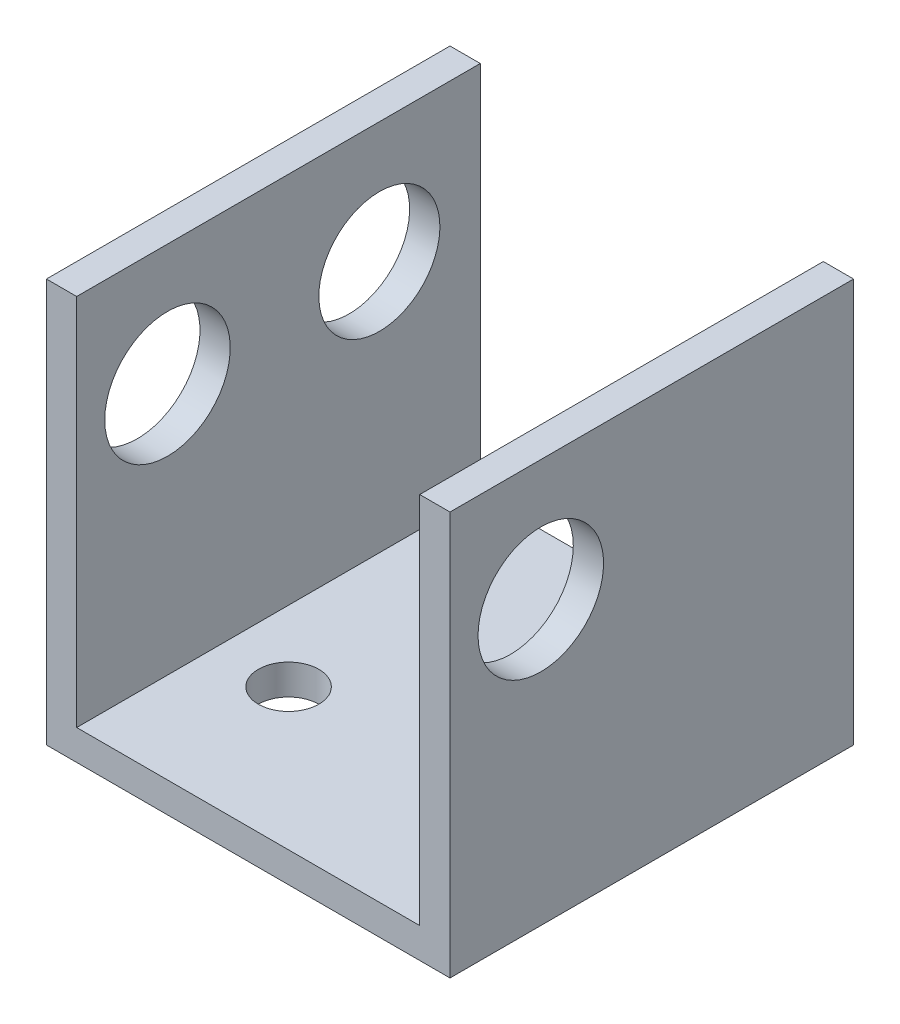
from build123d import *

# Parameters (mm, degrees)
EXTRUSION1_DEPTH = 20
ESQUISSE2_R      = 1.5
EXTRUSION2_DEPTH = 42.382154348
ESQUISSE4_R      = 3
EXTRUSION3_DEPTH = 32.911544508
ESQUISSE5_R      = 3.11
EXTRUSION4_DEPTH = 33.803912463


with BuildPart() as part:
    # Esquisse1 → Extrusion1 (new body)
    with BuildSketch(Plane.XY):
        Polygon((-31.14855853, 3.383843017), (-29.64855853, 3.383843017), (-29.64855853, -15.116156983), (-12.64855853, -15.116156983), (-12.64855853, 3.383843017), (-11.14855853, 3.383843017), (-11.14855853, -16.616156983), (-31.14855853, -16.616156983), align=None)
    extrude(amount=EXTRUSION1_DEPTH)

    # Esquisse2 → Extrusion2 (cut, through all)
    with BuildSketch(Plane(origin=(0, -15.116156983, 0), x_dir=(-1, 0, 0), z_dir=(0, 1, 0))):
        with Locations((26.14855853, 13)):
            Circle(ESQUISSE2_R)
        with Locations((16.14855853, 7)):
            Circle(ESQUISSE2_R)
    extrude(amount=-EXTRUSION2_DEPTH, mode=Mode.SUBTRACT)

    # Esquisse4 → Extrusion3 (cut, through all)
    with BuildSketch(Plane(origin=(-29.64855853, 0, 0), x_dir=(0, 0, -1), z_dir=(1, 0, 0))):
        with Locations(Location((-5, -2.616156983, 0), (0, 0, 90))):
            Circle(ESQUISSE4_R)
    extrude(amount=-EXTRUSION3_DEPTH, mode=Mode.SUBTRACT)

    # Esquisse5 → Extrusion4 (cut, through all)
    with BuildSketch(Plane.ZY.offset(31.14855853)):
        with Locations((15.5, -2.616156983)):
            Circle(ESQUISSE5_R)
    extrude(amount=-EXTRUSION4_DEPTH, mode=Mode.SUBTRACT)


solid = part.part
